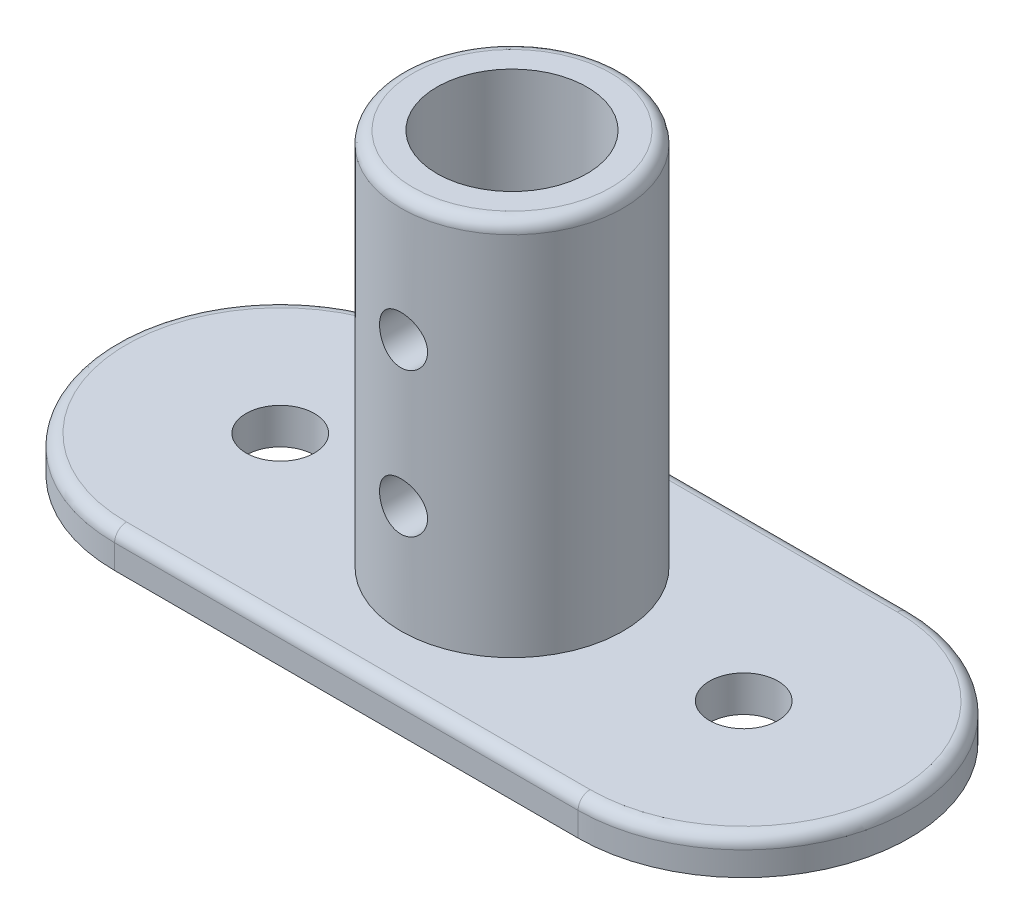
from build123d import *

# Parameters (mm, degrees)
SKETCH1_R           = 7.239
BOSS_EXTRUDE1_DEPTH = 7.62
SKETCH2_R           = 23.495
SKETCH2_R_2         = 15.875
BOSS_EXTRUDE2_DEPTH = 80.01
FILLET1_R           = 2.54
SKETCH4_R           = 5.08
CUT_EXTRUDE1_DEPTH  = 80.01


with BuildPart() as part:
    # Sketch1 → Boss-Extrude1 (new body)
    with BuildSketch(Plane(origin=(0, 0, 0), x_dir=(1, 0, 0), z_dir=(0, 1, 0))):
        with BuildLine():
            Line((-49.022, 35.052), (49.022, 35.052))
            ThreePointArc((49.022, 35.052), (84.074, 0), (49.022, -35.052))
            Line((49.022, -35.052), (-49.022, -35.052))
            ThreePointArc((-49.022, -35.052), (-84.074, 0), (-49.022, 35.052))
        make_face()
        with Locations(Location((-49.022, 0, 0), (0, 0, 90))):
            Circle(SKETCH1_R, mode=Mode.SUBTRACT)
        with Locations(Location((49.022, 0, 0), (0, 0, 90))):
            Circle(SKETCH1_R, mode=Mode.SUBTRACT)
        with Locations(Location((0, 0, 0), (0, 0, 90))):
            Circle(SKETCH1_R, mode=Mode.SUBTRACT)
    extrude(amount=BOSS_EXTRUDE1_DEPTH)

    # Sketch2 → Boss-Extrude2 (add)
    with BuildSketch(Plane(origin=(0, 7.62, 0), x_dir=(1, 0, 0), z_dir=(0, 1, 0))):
        with Locations(Location((0, 0, 0), (0, 0, 270))):
            Circle(SKETCH2_R)
        with Locations(Location((0, 0, 0), (0, 0, 270))):
            Circle(SKETCH2_R_2, mode=Mode.SUBTRACT)
    extrude(amount=BOSS_EXTRUDE2_DEPTH)

    # Fillet1
    fillet1_edges = [part.edges().sort_by_distance(p)[0] for p in [
        (84.074, 7.62, 0),
        (0, 7.62, -35.052),
        (0, 87.63, -23.495),
        (-84.074, 7.62, 0),
        (0, 7.62, 35.052),
    ]]
    fillet(fillet1_edges, radius=FILLET1_R)

    # Sketch4 → Cut-Extrude1 (cut)
    with BuildSketch(Plane.XY):
        with Locations(Location((0, 60.96, 0), (0, 0, 180))):
            Circle(SKETCH4_R)
        with Locations(Location((0, 30.48, 0), (0, 0, 180))):
            Circle(SKETCH4_R)
    extrude(amount=CUT_EXTRUDE1_DEPTH, mode=Mode.SUBTRACT)


solid = part.part
